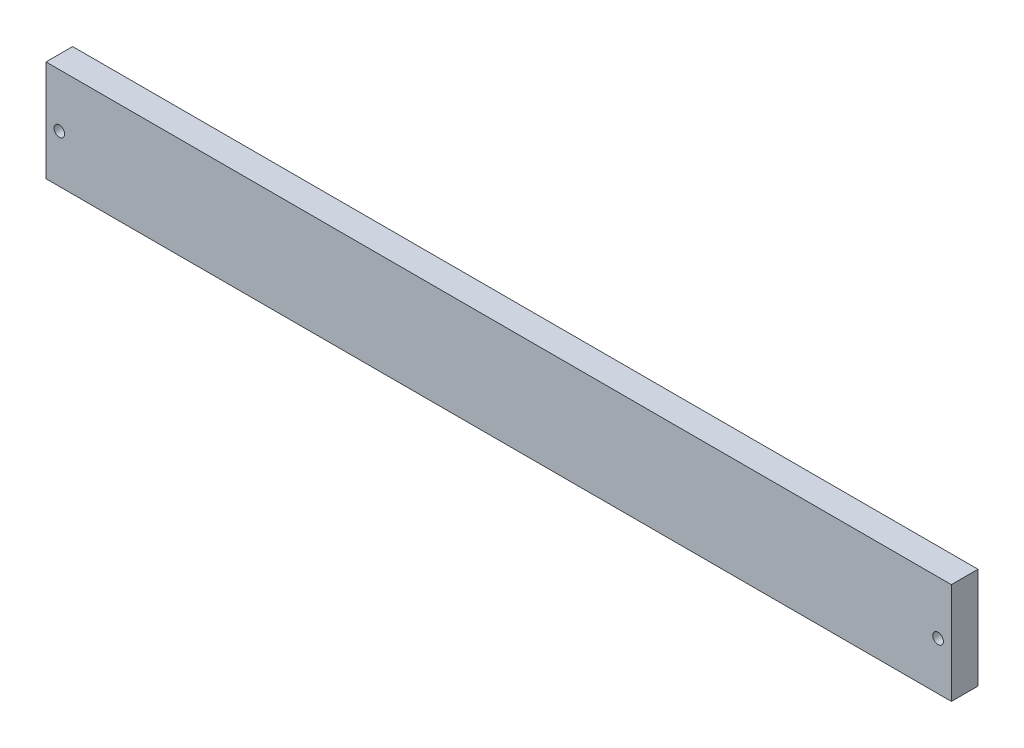
from build123d import *

# Parameters (mm, degrees)
ESQUISSE1_W                  = 340
ESQUISSE1_H                  = 38
BOSS_EXTRU_1_DEPTH           = 10
ENL_V_MAT_EXTRU_1_DEPTH      = 343.263056727
ENL_V_MAT_EXTRU_1_DEPTH_BACK = 343.263056727
ESQUISSE2_R                  = 2


with BuildPart() as part:
    # Esquisse1 → Boss.-Extru.1 (new body)
    with BuildSketch(Plane.XY):
        with Locations((170, 19)):
            Rectangle(ESQUISSE1_W, ESQUISSE1_H)
    extrude(amount=BOSS_EXTRU_1_DEPTH)

    # Esquisse2 → Enlèv. mat.-Extru.1 (cut, two sides: drawn at the far end of the back side and taken through both)
    with BuildSketch(Plane.XY.offset(10).offset(-ENL_V_MAT_EXTRU_1_DEPTH_BACK)):
        with Locations((5, 18)):
            Circle(ESQUISSE2_R)
        with Locations(Location((335, 18, 0), (0, 0, 180))):
            Circle(ESQUISSE2_R)
    extrude(amount=ENL_V_MAT_EXTRU_1_DEPTH + ENL_V_MAT_EXTRU_1_DEPTH_BACK, mode=Mode.SUBTRACT)


solid = part.part
